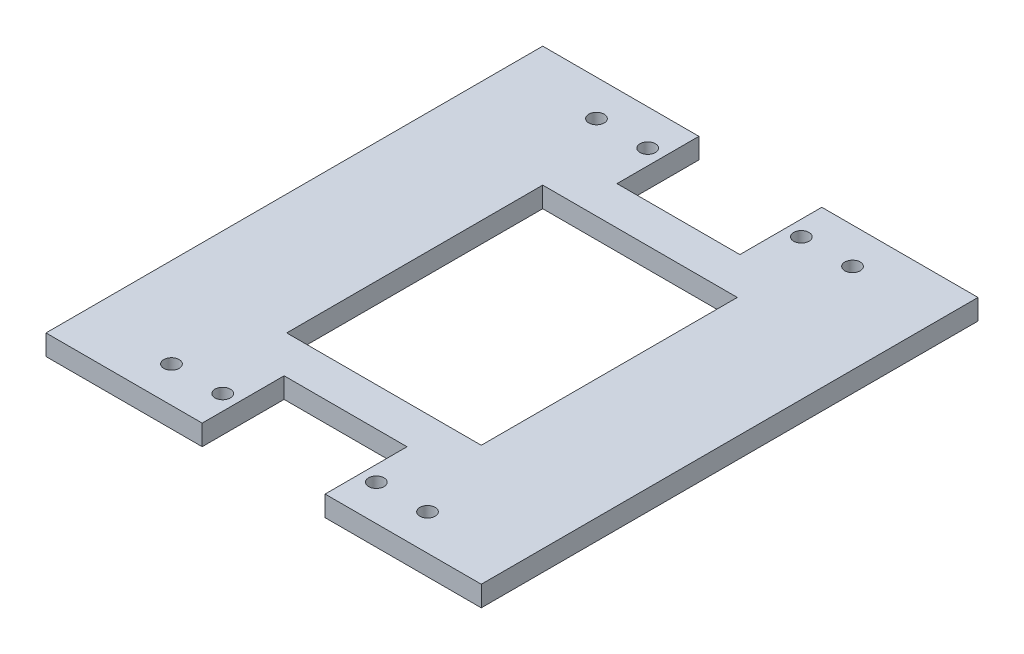
from build123d import *

# Parameters (mm, degrees)
SKETCH_1_R      = 1.5
SKETCH_1_W      = 38
SKETCH_1_H      = 50
EXTRUDE_1_DEPTH = 4


with BuildPart() as part:
    # 草图1 → 凸台-拉伸1 (new body)
    with BuildSketch(Plane(origin=(0, 0, 0), x_dir=(1, 0, 0), z_dir=(0, 1, 0))):
        Polygon((-12, 48.5), (-12, 32.5), (12, 32.5), (12, 48.5), (42.5, 48.5), (42.5, -48.5), (12, -48.5), (12, -32.5), (-12, -32.5), (-12, -48.5), (-42.5, -48.5), (-42.5, 48.5), align=None)
        with Locations(Location((15, 41.5, 0), (0, 0, 270))):
            Circle(SKETCH_1_R, mode=Mode.SUBTRACT)
        with Locations(Location((25, 41.5, 0), (0, 0, 270))):
            Circle(SKETCH_1_R, mode=Mode.SUBTRACT)
        with Locations(Location((-25, 41.5, 0), (0, 0, 90))):
            Circle(SKETCH_1_R, mode=Mode.SUBTRACT)
        with Locations(Location((-15, 41.5, 0), (0, 0, 90))):
            Circle(SKETCH_1_R, mode=Mode.SUBTRACT)
        with Locations(Location((25, -41.5, 0), (0, 0, 90))):
            Circle(SKETCH_1_R, mode=Mode.SUBTRACT)
        with Locations(Location((15, -41.5, 0), (0, 0, 90))):
            Circle(SKETCH_1_R, mode=Mode.SUBTRACT)
        with Locations(Location((-15, -41.5, 0), (0, 0, 270))):
            Circle(SKETCH_1_R, mode=Mode.SUBTRACT)
        with Locations(Location((-25, -41.5, 0), (0, 0, 270))):
            Circle(SKETCH_1_R, mode=Mode.SUBTRACT)
        Rectangle(SKETCH_1_W, SKETCH_1_H, mode=Mode.SUBTRACT)
    extrude(amount=EXTRUDE_1_DEPTH)


solid = part.part
